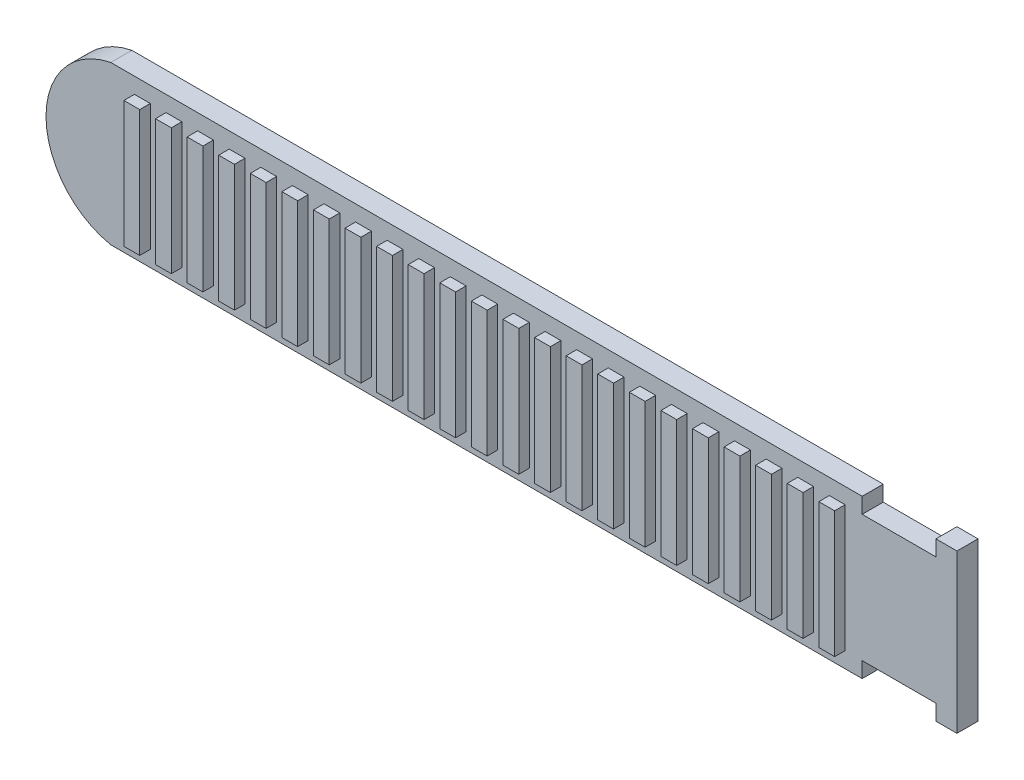
from build123d import *

# Parameters (mm, degrees)
EXTRUDE_1_DEPTH = 2
SKETCH_2_W      = 1.5
SKETCH_2_H      = 12
EXTRUDE_2_DEPTH = 1
SCALE_1_SCALE   = 1.6


with BuildPart() as part:
    # 草图1 → 凸台-拉伸1 (new body)
    with BuildSketch(Plane.XY):
        with BuildLine():
            Line((0, 7.5), (71.36690944, 7.5))
            Line((71.36690944, 7.5), (71.36690944, 6.01680195))
            Line((71.36690944, 6.01680195), (78.36690944, 6.01680195))
            Line((78.36690944, 6.01680195), (78.36690944, 7.5))
            Line((78.36690944, 7.5), (80.36690944, 7.5))
            Line((80.36690944, 7.5), (80.36690944, -7.5))
            Line((80.36690944, -7.5), (78.36690944, -7.5))
            Line((78.36690944, -7.5), (78.36690944, -6.01680195))
            Line((78.36690944, -6.01680195), (71.36690944, -6.01680195))
            Line((71.36690944, -6.01680195), (71.36690944, -7.5))
            Line((71.36690944, -7.5), (0, -7.5))
            ThreePointArc((0, -7.5), (-6.151670717, 0), (0, 7.5))
        make_face()
    extrude(amount=EXTRUDE_1_DEPTH)

    # 草图2 → 凸台-拉伸2 (add)
    with BuildSketch(Plane.XY.offset(2)):
        with Locations((3, 0)):
            Rectangle(SKETCH_2_W, SKETCH_2_H)
        with Locations((6, 0)):
            Rectangle(SKETCH_2_W, SKETCH_2_H)
        with Locations((9, 0)):
            Rectangle(SKETCH_2_W, SKETCH_2_H)
        with Locations((12, 0)):
            Rectangle(SKETCH_2_W, SKETCH_2_H)
        with Locations((15, 0)):
            Rectangle(SKETCH_2_W, SKETCH_2_H)
        with Locations((18, 0)):
            Rectangle(SKETCH_2_W, SKETCH_2_H)
        with Locations((21, 0)):
            Rectangle(SKETCH_2_W, SKETCH_2_H)
        with Locations((24, 0)):
            Rectangle(SKETCH_2_W, SKETCH_2_H)
        with Locations((27, 0)):
            Rectangle(SKETCH_2_W, SKETCH_2_H)
        with Locations((30, 0)):
            Rectangle(SKETCH_2_W, SKETCH_2_H)
        with Locations((33, 0)):
            Rectangle(SKETCH_2_W, SKETCH_2_H)
        with Locations((36, 0)):
            Rectangle(SKETCH_2_W, SKETCH_2_H)
        with Locations((39, 0)):
            Rectangle(SKETCH_2_W, SKETCH_2_H)
        with Locations((42, 0)):
            Rectangle(SKETCH_2_W, SKETCH_2_H)
        with Locations((45, 0)):
            Rectangle(SKETCH_2_W, SKETCH_2_H)
        with Locations((48, 0)):
            Rectangle(SKETCH_2_W, SKETCH_2_H)
        with Locations((51, 0)):
            Rectangle(SKETCH_2_W, SKETCH_2_H)
        with Locations((54, 0)):
            Rectangle(SKETCH_2_W, SKETCH_2_H)
        with Locations((57, 0)):
            Rectangle(SKETCH_2_W, SKETCH_2_H)
        with Locations((60, 0)):
            Rectangle(SKETCH_2_W, SKETCH_2_H)
        with Locations((63, 0)):
            Rectangle(SKETCH_2_W, SKETCH_2_H)
        with Locations((66, 0)):
            Rectangle(SKETCH_2_W, SKETCH_2_H)
        with Locations((69, 0)):
            Rectangle(SKETCH_2_W, SKETCH_2_H)
    extrude(amount=EXTRUDE_2_DEPTH)


with BuildPart() as part_1:
    # 缩放比例1: scaled about (37.07427317, 0, 1.212543803)
    add(part.part.scale(SCALE_1_SCALE).moved(Location((-22.244563902, 0, -0.727526282))))


solid = part_1.part
